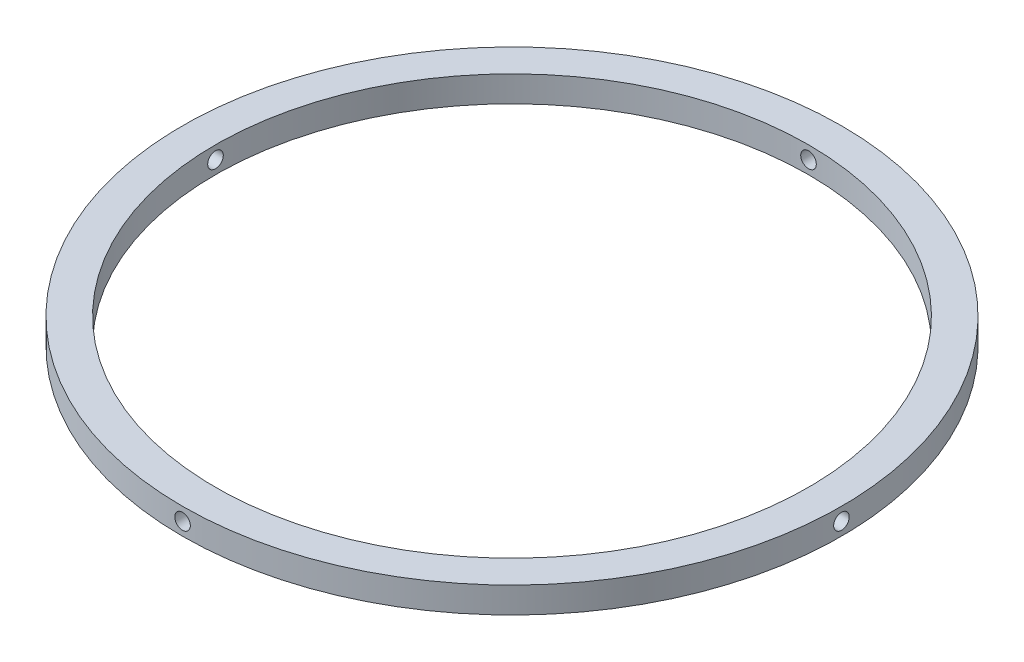
from build123d import *

# Parameters (mm, degrees)
OUTER_RING_MAIN_SKETCH_R   = 63.5
OUTER_RING_MAIN_BODY_DEPTH = 5
CENTER_HOLE_SKETCH_R       = 57.15
CENTER_HOLE_DEPTH          = 90.94164775
PIN_HOLE_DEPTH             = 90.94164775
PIN_HOLE_DEPTH_BACK        = 90.94164775
PIN_HOLE_SKETCH_R          = 1.5
PIN_HOLE_2_DEPTH           = 90.941647898
PIN_HOLE_2_DEPTH_BACK      = 90.941647898
PIN_HOLE_2_SKETCH_R        = 1.5


with BuildPart() as part:
    # Outer Ring Main Sketch → Outer Ring Main Body (new body)
    with BuildSketch(Plane(origin=(0, 0, 0), x_dir=(1, 0, 0), z_dir=(0, 1, 0))):
        with Locations(Location((0, 0, 0), (0, 0, 270))):
            Circle(OUTER_RING_MAIN_SKETCH_R)
    extrude(amount=OUTER_RING_MAIN_BODY_DEPTH)

    # Center Hole Sketch → Center Hole (cut, through all)
    with BuildSketch(Plane.XZ):
        with Locations(Location((0, 0, 0), (0, 0, 270))):
            Circle(CENTER_HOLE_SKETCH_R)
    extrude(amount=-CENTER_HOLE_DEPTH, mode=Mode.SUBTRACT)

    # Pin Hole Sketch → Pin Hole (cut, two sides: drawn at the far end of the back side and taken through both)
    with BuildSketch(Plane.XY.offset(-PIN_HOLE_DEPTH_BACK)):
        with Locations((0, 2.5)):
            Circle(PIN_HOLE_SKETCH_R)
    extrude(amount=PIN_HOLE_DEPTH + PIN_HOLE_DEPTH_BACK, mode=Mode.SUBTRACT)

    # Pin Hole 2 Sketch → Pin Hole 2 (cut, two sides: drawn at the far end of the back side and taken through both)
    with BuildSketch(Plane(origin=(0, 0, 0), x_dir=(0, 0, -1), z_dir=(1, 0, 0)).offset(-PIN_HOLE_2_DEPTH_BACK)):
        with Locations((0, 2.5)):
            Circle(PIN_HOLE_2_SKETCH_R)
    extrude(amount=PIN_HOLE_2_DEPTH + PIN_HOLE_2_DEPTH_BACK, mode=Mode.SUBTRACT)


solid = part.part
